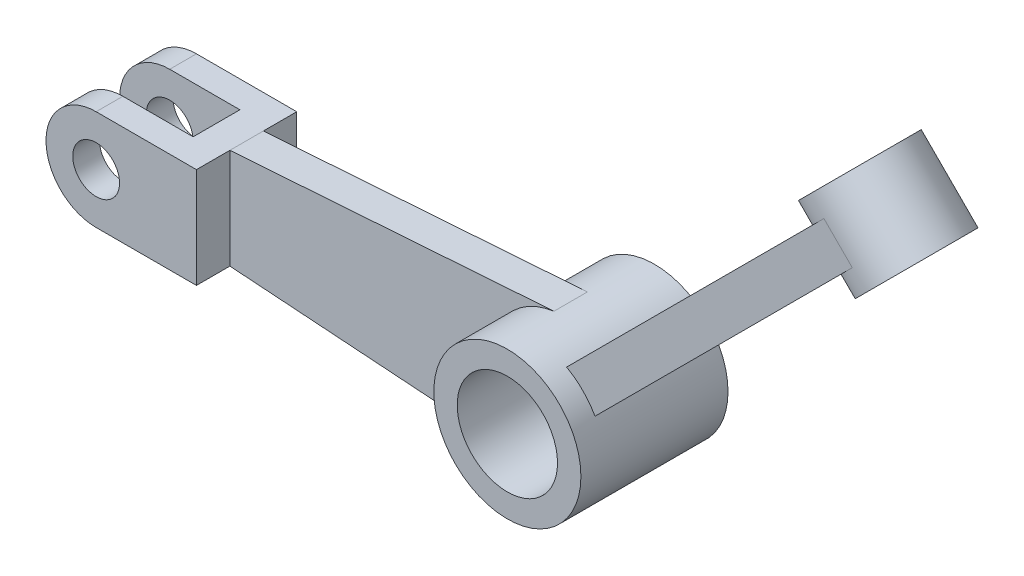
from build123d import *

# Parameters (mm, degrees)
RESSALTO_EXTRUS_O1_DEPTH   = 7.5
ESBO_O2_R                  = 11
RESSALTO_EXTRUS_O2_DEPTH   = 11
RESSALTO_EXTRUS_O4_DEPTH   = 2.5
RESSALTO_EXTRUS_O5_DEPTH   = 7.5
ESBO_O5_R                  = 7.5
RESSALTO_EXTRUS_O6_DEPTH   = 6
ESBO_O6_W                  = 21
ESBO_O6_H                  = 7
CORTE_EXTRUS_O1_DEPTH      = 88.647057938
CORTE_EXTRUS_O3_DEPTH      = 92.969424267
CORTE_EXTRUS_O3_DEPTH_BACK = 92.969424267
ESBO_O7_R                  = 3.5
CORTE_EXTRUS_O5_DEPTH      = 92.969424267
CORTE_EXTRUS_O5_DEPTH_BACK = 92.969424267
ESBO_O8_R                  = 7.5
CORTE_EXTRUS_O6_DEPTH      = 87.070855116
CORTE_EXTRUS_O6_DEPTH_BACK = 87.070855116
ESBO_O9_R                  = 3.5


with BuildPart() as part:
    # Esboço1 → Ressalto-extrusão1 (new, symmetric)
    with BuildSketch(Plane.XY):
        with BuildLine():
            Line((-65, 7.5), (-50, 7.5))
            Line((-50, 7.5), (-50, -7.5))
            Line((-50, -7.5), (-65, -7.5))
            ThreePointArc((-65, -7.5), (-72.5, 0), (-65, 7.5))
        make_face()
    extrude(amount=RESSALTO_EXTRUS_O1_DEPTH, both=True)



with BuildPart() as body_2:
    # Esboço2 → Ressalto-extrusão2 (new, symmetric)
    with BuildSketch(Plane.XY):
        Circle(ESBO_O2_R)
    extrude(amount=RESSALTO_EXTRUS_O2_DEPTH, both=True)


with BuildPart() as part_1:
    add(part.part)

    add(body_2.part)  # Ressalto-extrusão4 merges body 2
    # Esboço3 → Ressalto-extrusão4 (add, symmetric)
    with BuildSketch(Plane.XY):
        Polygon((-50, 7.5), (0, 11), (0, -11), (-50, -7.5), align=None)
    extrude(amount=RESSALTO_EXTRUS_O4_DEPTH, both=True)

    # Esboço4 → Ressalto-extrusão5 (add, symmetric)
    with BuildSketch(Plane.XY):
        Polygon((2.121320344, -2.121320344), (48.083261121, 43.840620434), (43.840620434, 48.083261121), (-2.121320344, 2.121320344), align=None)
    extrude(amount=RESSALTO_EXTRUS_O5_DEPTH, both=True)

    # Esboço5 → Ressalto-extrusão6 (add, symmetric)
    with BuildSketch(Plane(origin=(0, 0, 0), x_dir=(0, 0, 1), z_dir=(-0.7071067811865488, 0.7071067811865464, 0))):
        with Locations(Location((0, 65, 0), (0, 0, 270))):
            Circle(ESBO_O5_R)
    extrude(amount=RESSALTO_EXTRUS_O6_DEPTH, both=True)

    # Esboço6 → Corte-extrusão1 (cut, through all)
    with BuildSketch(Plane(origin=(0, 7.5, 0), x_dir=(1, 0, 0), z_dir=(0, 1, 0))):
        with Locations((-65, 0)):
            Rectangle(ESBO_O6_W, ESBO_O6_H)
    extrude(amount=-CORTE_EXTRUS_O1_DEPTH, mode=Mode.SUBTRACT)

    # Esboço7 → Corte-extrusão3 (cut, two sides: drawn at the far end of the back side and taken through both)
    with BuildSketch(Plane.XY.offset(-CORTE_EXTRUS_O3_DEPTH_BACK)):
        with Locations((-65, 0)):
            Circle(ESBO_O7_R)
    extrude(amount=CORTE_EXTRUS_O3_DEPTH + CORTE_EXTRUS_O3_DEPTH_BACK, mode=Mode.SUBTRACT)

    # Esboço8 → Corte-extrusão5 (cut, two sides: drawn at the far end of the back side and taken through both)
    with BuildSketch(Plane.XY.offset(-CORTE_EXTRUS_O5_DEPTH_BACK)):
        Circle(ESBO_O8_R)
    extrude(amount=CORTE_EXTRUS_O5_DEPTH + CORTE_EXTRUS_O5_DEPTH_BACK, mode=Mode.SUBTRACT)

    # Esboço9 → Corte-extrusão6 (cut, two sides: drawn at the far end of the back side and taken through both)
    with BuildSketch(Plane(origin=(-4.242640687, 4.242640687, 0), x_dir=(0, 0, 1), z_dir=(-0.7071067811865487, 0.7071067811865465, 0)).offset(-CORTE_EXTRUS_O6_DEPTH_BACK)):
        with Locations(Location((0, 65, 0), (0, 0, 270))):
            Circle(ESBO_O9_R)
    extrude(amount=CORTE_EXTRUS_O6_DEPTH + CORTE_EXTRUS_O6_DEPTH_BACK, mode=Mode.SUBTRACT)


solid = part_1.part
